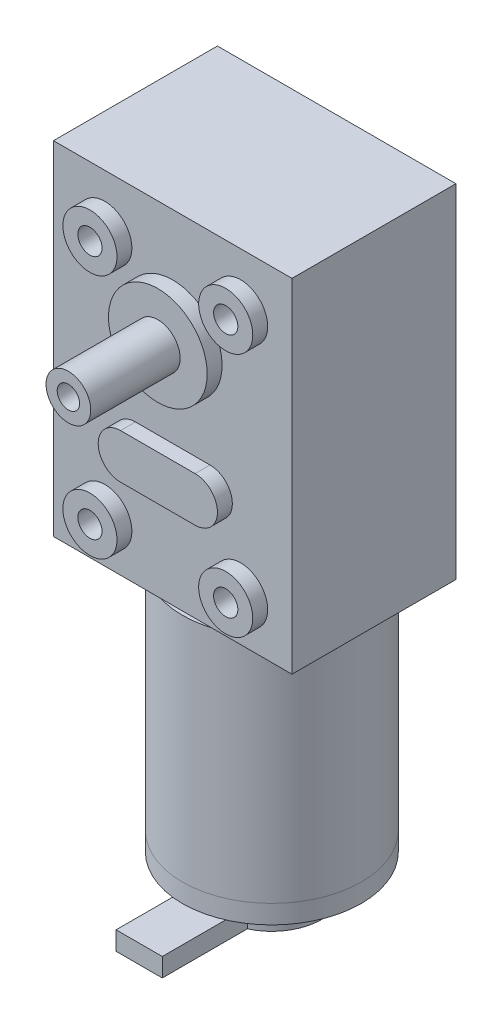
from build123d import *

# Parameters (mm, degrees)
SKETCH1_W                = 32
SKETCH1_H                = 46
SKETCH1_R                = 3.63
BOSS_EXTRUDE1_DEPTH      = 22
BOSS_EXTRUDE2_DEPTH      = 2
BOSS_EXTRUDE2_DEPTH_BACK = 22
SKETCH1_3_R              = 3.63
SKETCH1_3_R_2            = 1.625
SKETCH1_4_R              = 3
SKETCH1_4_R_2            = 1.5
BOSS_EXTRUDE3_DEPTH      = 14
SKETCH1_5_R              = 6.62
SKETCH1_5_R_2            = 3
BOSS_EXTRUDE4_DEPTH      = 2
CUT_EXTRUDE1_START       = -12
SKETCH1_6_R              = 1.625
SKETCH1_6_R_2            = 1.5
CUT_EXTRUDE1_DEPTH       = 12
CUT_EXTRUDE2_DEPTH       = 12
CUT_EXTRUDE2_DEPTH_BACK  = 12
SKETCH1_7_R              = 1.625
SKETCH2_R                = 12
BOSS_EXTRUDE5_DEPTH      = 31
SKETCH3_R                = 12
BOSS_EXTRUDE6_DEPTH      = 2.5
SKETCH4_R                = 6.7
BOSS_EXTRUDE7_DEPTH      = 4.5
SKETCH5_W                = 1.6
SKETCH5_H                = 2.5
SKETCH5_W_2              = 1.2
SKETCH5_W_3              = 1
CUT_EXTRUDE4_DEPTH       = 6
BOSS_EXTRUDE9_DEPTH      = 6
BOSS_EXTRUDE9_DEPTH_BACK = 6
SKETCH5_4_W              = 1.2
SKETCH5_4_H              = 2.5
SKETCH5_4_W_2            = 1
SKETCH5_4_W_3            = 1.6


with BuildPart() as part:
    # Sketch1 → Boss-Extrude1 (new body)
    with BuildSketch(Plane.XY):
        Rectangle(SKETCH1_W, SKETCH1_H)
        with Locations((9.11, 15.77)):
            Circle(SKETCH1_R, mode=Mode.SUBTRACT)
        with BuildLine():
            Line((-5, -4.1875), (5, -4.1875))
            ThreePointArc((5, -4.1875), (8, -7.1875), (5, -10.1875))
            Line((5, -10.1875), (-5, -10.1875))
            ThreePointArc((-5, -10.1875), (-8, -7.1875), (-5, -4.1875))
        make_face(mode=Mode.SUBTRACT)
    extrude(amount=-BOSS_EXTRUDE1_DEPTH)

    # Sketch1<3> → Boss-Extrude2 (add, two sides: drawn at the far end of the back side and taken through both)
    # profile 1 of 5: a face of its own
    with BuildSketch(Plane.XY.offset(-BOSS_EXTRUDE2_DEPTH_BACK)):
        with Locations((9.11, 15.77)):
            Circle(SKETCH1_3_R)
    # profile 2 of 5: a face of its own
    with BuildSketch(Plane.XY.offset(-BOSS_EXTRUDE2_DEPTH_BACK)):
        with Locations((9.11, -17.13)):
            Circle(SKETCH1_3_R)
        with Locations((9.11, -17.13)):
            Circle(SKETCH1_3_R_2, mode=Mode.SUBTRACT)
    # profile 3 of 5: a face of its own
    with BuildSketch(Plane.XY.offset(-BOSS_EXTRUDE2_DEPTH_BACK)):
        with Locations((-9.11, -17.13)):
            Circle(SKETCH1_3_R)
        with Locations((-9.11, -17.13)):
            Circle(SKETCH1_3_R_2, mode=Mode.SUBTRACT)
    # profile 4 of 5: a face of its own
    with BuildSketch(Plane.XY.offset(-BOSS_EXTRUDE2_DEPTH_BACK)):
        with Locations((-9.11, 15.77)):
            Circle(SKETCH1_3_R)
        with Locations((-9.11, 15.77)):
            Circle(SKETCH1_3_R_2, mode=Mode.SUBTRACT)
    # profile 5 of 5: a face of its own
    with BuildSketch(Plane.XY.offset(-BOSS_EXTRUDE2_DEPTH_BACK)):
        with BuildLine():
            Line((-5, -4.1875), (5, -4.1875))
            ThreePointArc((5, -4.1875), (8, -7.1875), (5, -10.1875))
            Line((5, -10.1875), (-5, -10.1875))
            ThreePointArc((-5, -10.1875), (-8, -7.1875), (-5, -4.1875))
        make_face()
    extrude(amount=BOSS_EXTRUDE2_DEPTH + BOSS_EXTRUDE2_DEPTH_BACK)

    # Sketch1<4> → Boss-Extrude3 (add)
    with BuildSketch(Plane.XY):
        with Locations((0, 8.2)):
            Circle(SKETCH1_4_R)
        with Locations((0, 8.2)):
            Circle(SKETCH1_4_R_2, mode=Mode.SUBTRACT)
    extrude(amount=BOSS_EXTRUDE3_DEPTH)

    # Sketch1<5> → Boss-Extrude4 (add)
    with BuildSketch(Plane.XY):
        with Locations((0, 8.2)):
            Circle(SKETCH1_5_R)
        with Locations((0, 8.2)):
            Circle(SKETCH1_5_R_2, mode=Mode.SUBTRACT)
    extrude(amount=BOSS_EXTRUDE4_DEPTH)

    # Sketch1<6> → Cut-Extrude1 (cut)
    with BuildSketch(Plane.XY.offset(CUT_EXTRUDE1_START)):
        with Locations((-9.11, 15.77)):
            Circle(SKETCH1_6_R)
        with Locations((0, 8.2)):
            Circle(SKETCH1_6_R_2)
        with Locations((-9.11, -17.13)):
            Circle(SKETCH1_6_R)
        with Locations((9.11, -17.13)):
            Circle(SKETCH1_6_R)
        with Locations((9.11, 15.77)):
            Circle(SKETCH1_6_R)
    extrude(amount=CUT_EXTRUDE1_DEPTH, mode=Mode.SUBTRACT)

    # Sketch1<7> → Cut-Extrude2 (cut, two sides: drawn at the far end of the back side and taken through both)
    with BuildSketch(Plane.XY.offset(-CUT_EXTRUDE2_DEPTH_BACK)):
        with Locations((9.11, 15.77)):
            Circle(SKETCH1_7_R)
    extrude(amount=CUT_EXTRUDE2_DEPTH + CUT_EXTRUDE2_DEPTH_BACK, mode=Mode.SUBTRACT)


with BuildPart() as body_2:
    # Sketch2 → Boss-Extrude5 (new body)
    with BuildSketch(Plane.XZ.offset(23)):
        with Locations(Location((1.8, -11.5, 0), (0, 0, 270))):
            Circle(SKETCH2_R)
    extrude(amount=BOSS_EXTRUDE5_DEPTH)


with BuildPart() as body_3:
    # Sketch3 → Boss-Extrude6 (new body)
    with BuildSketch(Plane.XZ.offset(54)):
        with Locations(Location((1.8, -11.5, 0), (0, 0, 270))):
            Circle(SKETCH3_R)
    extrude(amount=BOSS_EXTRUDE6_DEPTH)


with BuildPart() as body_4:
    # Sketch4 → Boss-Extrude7 (new body)
    with BuildSketch(Plane.XZ.offset(56.5)):
        with Locations(Location((1.8, -11.5, 0), (0, 0, 270))):
            Circle(SKETCH4_R)
    extrude(amount=BOSS_EXTRUDE7_DEPTH)

    # Sketch5 → Cut-Extrude4 (cut)
    with BuildSketch(Plane.XY):
        with Locations((3.8, -59.75)):
            Rectangle(SKETCH5_W, SKETCH5_H)
        with Locations((2.4, -59.75)):
            Rectangle(SKETCH5_W_2, SKETCH5_H)
        with Locations((1.3, -59.75)):
            Rectangle(SKETCH5_W_3, SKETCH5_H)
        with Locations((0.2, -59.75)):
            Rectangle(SKETCH5_W_2, SKETCH5_H)
        with Locations((-1, -59.75)):
            Rectangle(SKETCH5_W_2, SKETCH5_H)
    extrude(amount=-CUT_EXTRUDE4_DEPTH, mode=Mode.SUBTRACT)


with BuildPart() as body_5:
    # Sketch5<4> → Boss-Extrude9 (new, two sides: drawn at the far end of the back side and taken through both)
    with BuildSketch(Plane.XY.offset(-BOSS_EXTRUDE9_DEPTH_BACK)):
        with Locations((-1, -59.75)):
            Rectangle(SKETCH5_4_W, SKETCH5_4_H)
        with Locations((0.2, -59.75)):
            Rectangle(SKETCH5_4_W, SKETCH5_4_H)
        with Locations((1.3, -59.75)):
            Rectangle(SKETCH5_4_W_2, SKETCH5_4_H)
        with Locations((2.4, -59.75)):
            Rectangle(SKETCH5_4_W, SKETCH5_4_H)
        with Locations((3.8, -59.75)):
            Rectangle(SKETCH5_4_W_3, SKETCH5_4_H)
    extrude(amount=BOSS_EXTRUDE9_DEPTH + BOSS_EXTRUDE9_DEPTH_BACK)


solid = Compound([part.part, body_2.part, body_3.part, body_4.part, body_5.part])
